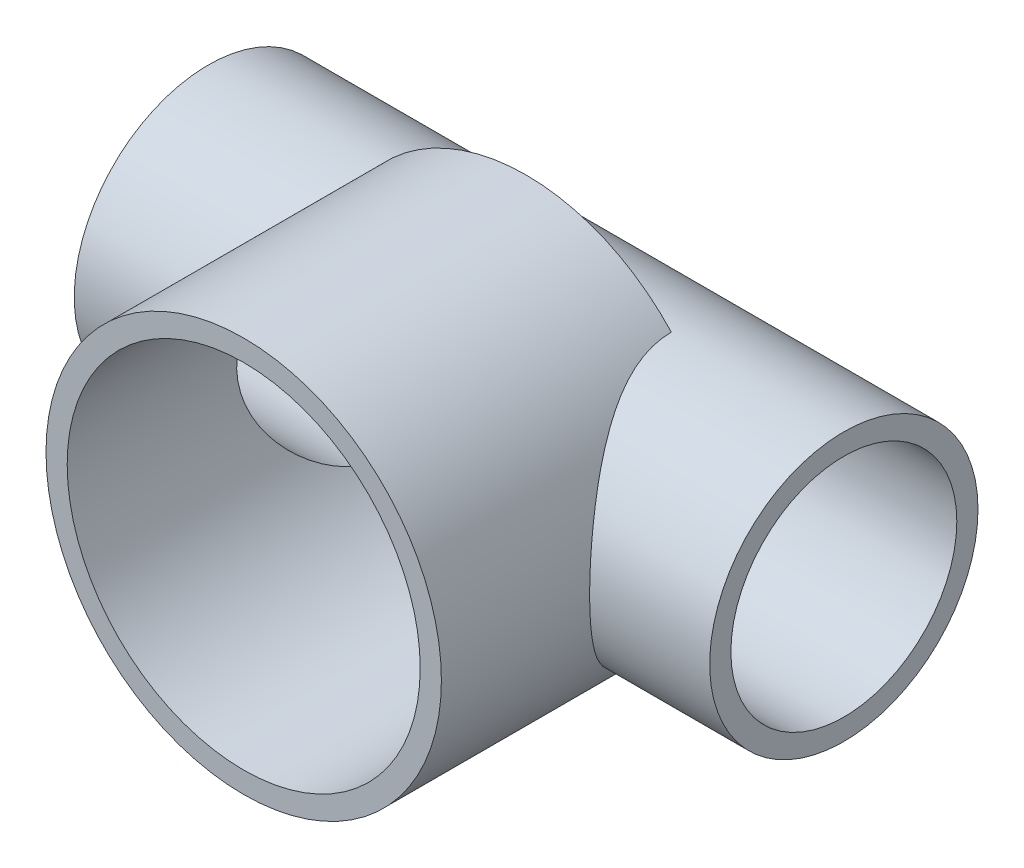
from build123d import *

# Parameters (mm, degrees)
SKETCH_1_R               = 14
SKETCH_1_R_2             = 12.5
EXTRUDE_1_DEPTH          = 20
EXTRUDE_2_DEPTH          = 22.5
EXTRUDE_2_DEPTH_BACK     = 22.5
SKETCH_2_R               = 9.5
SKETCH_2_R_2             = 8
CUT_EXTRUDE_1_DEPTH      = 40.654760284
CUT_EXTRUDE_1_DEPTH_BACK = 20
SKETCH_3_R               = 12.5
CUT_EXTRUDE_2_DEPTH      = 52.195703099
CUT_EXTRUDE_2_DEPTH_BACK = 52.195703099
SKETCH_4_R               = 8


with BuildPart() as part:
    # 草图1 → 凸台-拉伸1 (new body)
    with BuildSketch(Plane.XY):
        Circle(SKETCH_1_R)
        Circle(SKETCH_1_R_2, mode=Mode.SUBTRACT)
    extrude(amount=EXTRUDE_1_DEPTH)

    # 草图2 → 凸台-拉伸2 (add, two sides: drawn at the far end of the back side and taken through both)
    with BuildSketch(Plane(origin=(0, 0, 0), x_dir=(0, 0, -1), z_dir=(1, 0, 0)).offset(-EXTRUDE_2_DEPTH_BACK)):
        Circle(SKETCH_2_R)
        Circle(SKETCH_2_R_2, mode=Mode.SUBTRACT)
    extrude(amount=EXTRUDE_2_DEPTH + EXTRUDE_2_DEPTH_BACK)

    # 草图3 → 切除-拉伸1 (cut, two sides: drawn at the far end of the back side and taken through both)
    with BuildSketch(Plane.XY.offset(20).offset(-CUT_EXTRUDE_1_DEPTH_BACK)):
        Circle(SKETCH_3_R)
    extrude(amount=CUT_EXTRUDE_1_DEPTH + CUT_EXTRUDE_1_DEPTH_BACK, mode=Mode.SUBTRACT)

    # 草图4 → 切除-拉伸2 (cut, two sides: drawn at the far end of the back side and taken through both)
    with BuildSketch(Plane(origin=(22.5, 0, 0), x_dir=(0, 0, -1), z_dir=(1, 0, 0)).offset(-CUT_EXTRUDE_2_DEPTH_BACK)):
        Circle(SKETCH_4_R)
    extrude(amount=CUT_EXTRUDE_2_DEPTH + CUT_EXTRUDE_2_DEPTH_BACK, mode=Mode.SUBTRACT)


solid = part.part
